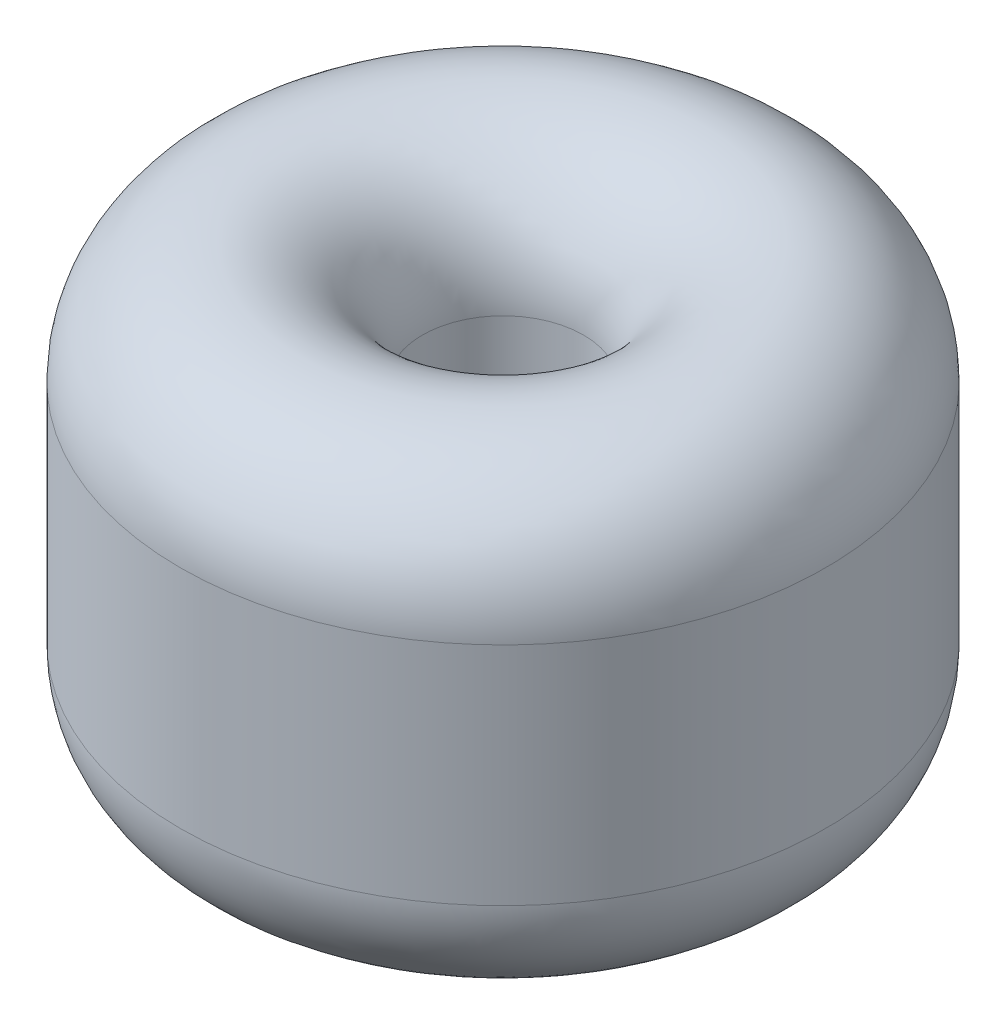
from build123d import *


with BuildPart() as part:
    # 草图1 → 旋转1 (revolve)
    with BuildSketch(Plane.XY, mode=Mode.PRIVATE) as revolve_1_sk:
        with BuildLine():
            Line((-40, 14), (-40, -14))
            ThreePointArc((-40, -14), (-25, -29), (-10, -14))
            Line((-10, -14), (-10, 14))
            ThreePointArc((-10, 14), (-25, 29), (-40, 14))
        make_face()
    revolve(revolve_1_sk.sketch.rotate(Axis((0, 0, 0), (0, 1, 0)), 270), axis=Axis((0, 0, 0), (0, 1, 0)))


solid = part.part
